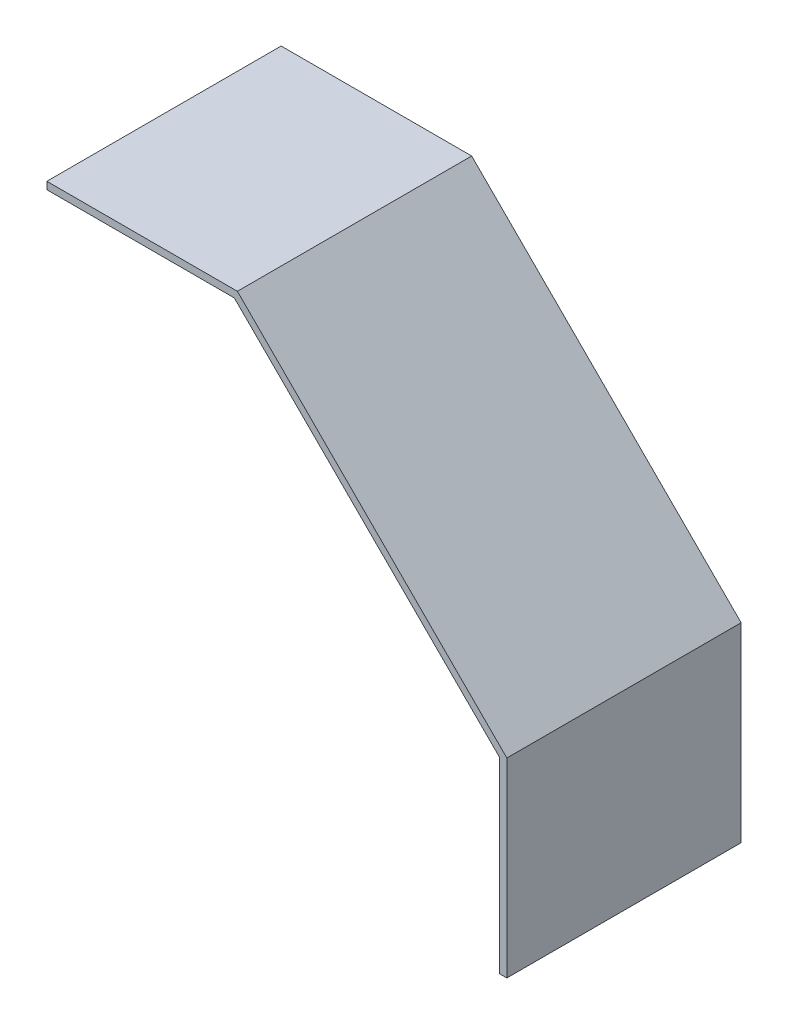
from build123d import *

# Parameters (mm, degrees)
BOSS_EXTRUDE1_DEPTH = 203.2


with BuildPart() as part:
    # Sketch1 → Boss-Extrude1 (new body)
    with BuildSketch(Plane.XY):
        Polygon((398.931182138, 165.242706095), (398.931182138, 0), (392.581182138, 0), (392.581182138, 162.612449974), (162.612449974, 392.581182138), (0, 392.581182138), (0, 398.931182138), (165.242706095, 398.931182138), align=None)
    extrude(amount=BOSS_EXTRUDE1_DEPTH)


solid = part.part
